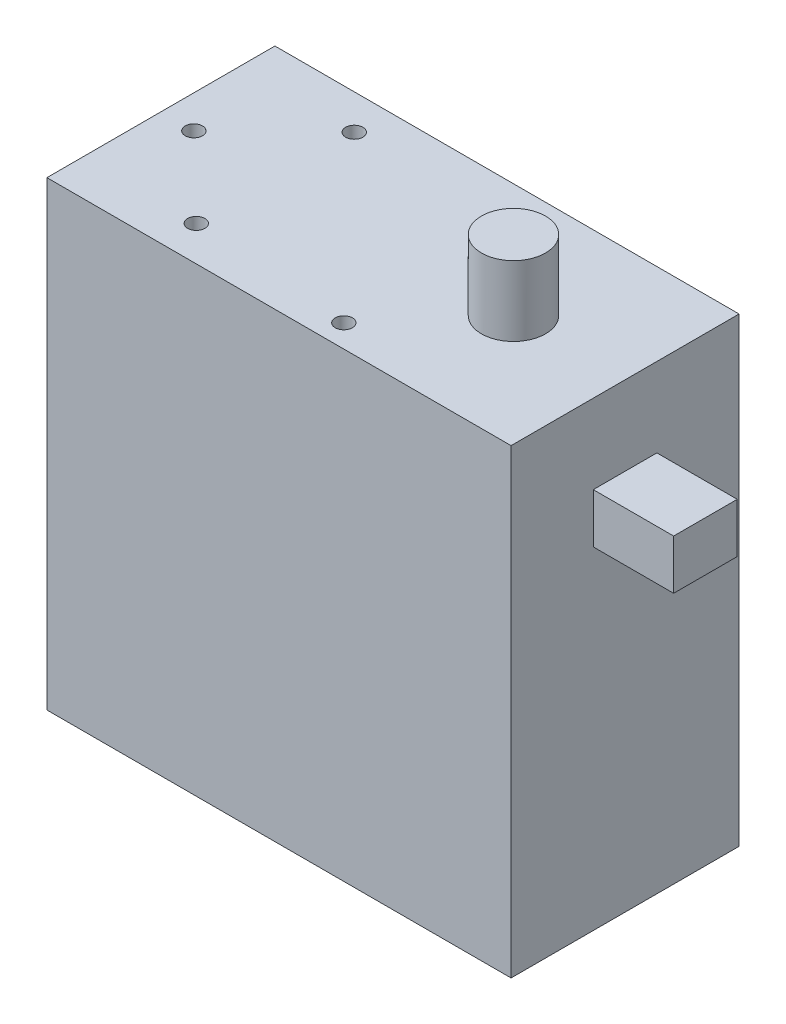
from build123d import *

# Parameters (mm, degrees)
SKETCH1_W              = 40.43
SKETCH1_H              = 40.16
SERVOBODY_DEPTH        = 19.86
SKETCH2_R              = 2.79
GEARHINGE_DEPTH        = 6.1
SKETCH3_R              = 3.01
SMOOTHHINGE_DEPTH      = 5.5
SKETCH4_R              = 0.75
GEARSCREWHOLES_DEPTH   = 2
SKETCH5_R              = 0.75
SMOOTHSCREWHOLES_DEPTH = 2
SKETCH6_W              = 5.54
SKETCH6_H              = 4.32
CABLE_DEPTH            = 7


with BuildPart() as part:
    # Sketch1 → ServoBody (new body)
    with BuildSketch(Plane.XY):
        with Locations((20.215, 20.08)):
            Rectangle(SKETCH1_W, SKETCH1_H)
    extrude(amount=SERVOBODY_DEPTH)

    # Sketch2 → GearHinge (add)
    with BuildSketch(Plane(origin=(0, 40.16, 0), x_dir=(1, 0, 0), z_dir=(0, 1, 0))):
        with Locations(Location((30.71, -9.93, 0), (0, 0, 90))):
            Circle(SKETCH2_R)
    extrude(amount=GEARHINGE_DEPTH)

    # Sketch3 → SmoothHinge (add)
    with BuildSketch(Plane.XZ):
        with Locations(Location((30.71, 9.93, 0), (0, 0, 90))):
            Circle(SKETCH3_R)
    extrude(amount=SMOOTHHINGE_DEPTH)

    # Sketch4 → GearScrewHoles (cut)
    with BuildSketch(Plane(origin=(0, 40.16, 0), x_dir=(1, 0, 0), z_dir=(0, 1, 0))):
        with Locations(Location((23.88, -1.98, 0), (0, 0, 270))):
            Circle(SKETCH4_R)
        with Locations(Location((23.88, -17.88, 0), (0, 0, 270))):
            Circle(SKETCH4_R)
        with Locations(Location((2.87, -9.93, 0), (0, 0, 270))):
            Circle(SKETCH4_R)
        with Locations(Location((9.96, -3.05, 0), (0, 0, 270))):
            Circle(SKETCH4_R)
        with Locations(Location((9.96, -16.81, 0), (0, 0, 270))):
            Circle(SKETCH4_R)
    extrude(amount=-GEARSCREWHOLES_DEPTH, mode=Mode.SUBTRACT)

    # Sketch5 → SmoothScrewHoles (cut)
    with BuildSketch(Plane.XZ):
        with Locations(Location((17.31, 17.86, 0), (0, 0, 270))):
            Circle(SKETCH5_R)
        with Locations(Location((38.43, 17.86, 0), (0, 0, 270))):
            Circle(SKETCH5_R)
        with Locations(Location((2.07, 17.86, 0), (0, 0, 270))):
            Circle(SKETCH5_R)
        with Locations(Location((17.31, 2, 0), (0, 0, 270))):
            Circle(SKETCH5_R)
        with Locations(Location((38.43, 2, 0), (0, 0, 270))):
            Circle(SKETCH5_R)
        with Locations(Location((2.07, 2, 0), (0, 0, 270))):
            Circle(SKETCH5_R)
    extrude(amount=-SMOOTHSCREWHOLES_DEPTH, mode=Mode.SUBTRACT)

    # Sketch6 → Cable (add)
    with BuildSketch(Plane(origin=(40.43, 0, 0), x_dir=(0, 0, -1), z_dir=(1, 0, 0))):
        with Locations((-9.93, 31.1)):
            Rectangle(SKETCH6_W, SKETCH6_H)
    extrude(amount=CABLE_DEPTH)


solid = part.part
